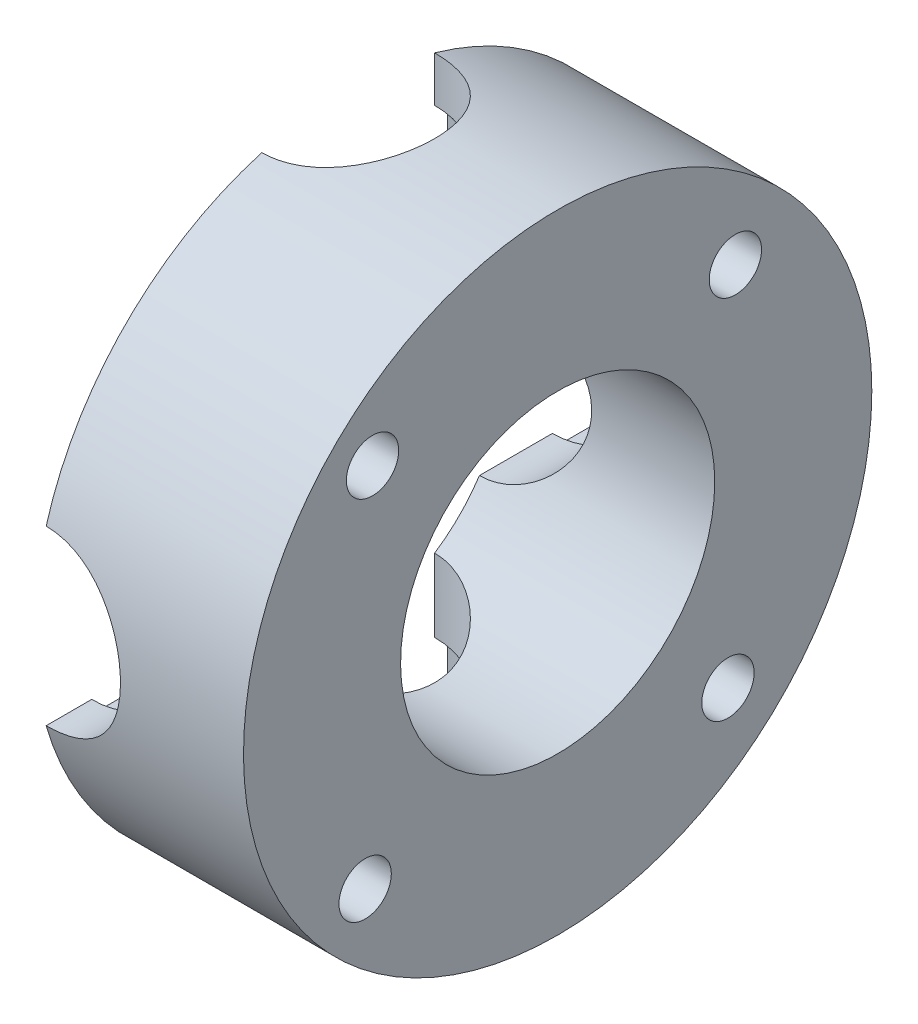
from build123d import *

# Parameters (mm, degrees)
SKETCH1_R           = 30
SKETCH1_R_2         = 15
BOSS_EXTRUDE1_DEPTH = 40
SKETCH2_R           = 9.5
CUT_EXTRUDE1_DEPTH  = 2.5
SKETCH3_R           = 8.25
CUT_EXTRUDE2_DEPTH  = 15
CIRPATTERN1_COUNT   = 4
SKETCH4_R           = 2.5
CUT_EXTRUDE3_DEPTH  = 47.904157769


with BuildPart() as part:
    # Sketch1 → Boss-Extrude1 (new body)
    with BuildSketch(Plane(origin=(0, 0, 0), x_dir=(0, 0, -1), z_dir=(1, 0, 0))):
        Circle(SKETCH1_R)
        Circle(SKETCH1_R_2, mode=Mode.SUBTRACT)
    extrude(amount=BOSS_EXTRUDE1_DEPTH)

    # Sketch2 → Cut-Extrude1 (cut, symmetric)
    with BuildSketch(Plane.XY.offset(22)):
        with Locations((20, 0)):
            Circle(SKETCH2_R)
    cut_extrude1 = extrude(amount=CUT_EXTRUDE1_DEPTH, both=True, mode=Mode.SUBTRACT)

    # Sketch3 → Cut-Extrude2 (cut, symmetric)
    with BuildSketch(Plane.XY.offset(22)):
        with Locations((20, 0)):
            Circle(SKETCH3_R)
    cut_extrude2 = extrude(amount=CUT_EXTRUDE2_DEPTH, both=True, mode=Mode.SUBTRACT)

    # CirPattern1: Cut-Extrude1, Cut-Extrude2 ×4 about axis
    cirpattern1_axis = Axis((40, 0, 0), (1, 0, 0))
    add([cut_extrude1.rotate(cirpattern1_axis, i * 360 / CIRPATTERN1_COUNT) for i in range(1, CIRPATTERN1_COUNT)], mode=Mode.SUBTRACT)
    add([cut_extrude2.rotate(cirpattern1_axis, i * 360 / CIRPATTERN1_COUNT) for i in range(1, CIRPATTERN1_COUNT)], mode=Mode.SUBTRACT)


with BuildPart() as body_2:
    # Split2: the piece on the far side of the plane
    add(part.part)
    split(bisect_by=Plane(origin=(20, 0, 0), x_dir=(0, 0, 1), z_dir=(1, 0, 0)), keep=Keep.BOTTOM)


with BuildPart() as part_1:
    add(part.part)

    # Split2
    split(bisect_by=Plane(origin=(20, 0, 0), x_dir=(0, 0, 1), z_dir=(1, 0, 0)), keep=Keep.TOP)

    # Sketch4 → Cut-Extrude3 (cut, through all)
    with BuildSketch(Plane(origin=(40, 0, 0), x_dir=(0, 0, -1), z_dir=(1, 0, 0))):
        with Locations((-17.67766953, 17.67766953)):
            Circle(SKETCH4_R)
        with Locations((16.970562748, 16.970562748)):
            Circle(SKETCH4_R)
        with Locations((16.263455967, -17.67766953)):
            Circle(SKETCH4_R)
        with Locations((-18.384776311, -16.970562748)):
            Circle(SKETCH4_R)
    extrude(amount=-CUT_EXTRUDE3_DEPTH, mode=Mode.SUBTRACT)


solid = part_1.part
